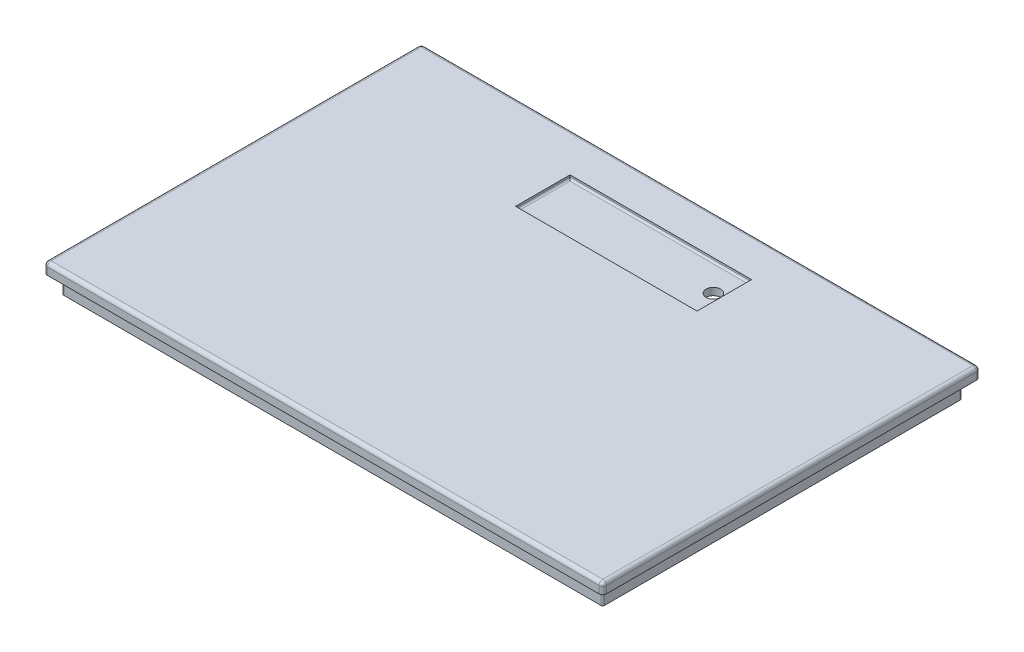
from build123d import *

# Parameters (mm, degrees)
SKETCH1_W           = 154
SKETCH1_H           = 104
BOSS_EXTRUDE1_DEPTH = 3
FILLET1_R           = 1
SKETCH2_W           = 149
SKETCH2_H           = 99
SKETCH2_W_2         = 145
SKETCH2_H_2         = 95
EXTRUDE_THIN1_DEPTH = 5
FILLET2_R           = 3
FILLET3_R           = 1
CUT_REVOLVE1_ANGLE  = 90
SKETCH5_W           = 50
SKETCH5_H           = 15
CUT_EXTRUDE1_DEPTH  = 1
FILLET4_R           = 0.5
SKETCH6_R           = 2
CUT_EXTRUDE2_DEPTH  = 5
FILLET5_R           = 0.5


with BuildPart() as part:
    # Sketch1 → Boss-Extrude1 (new body)
    with BuildSketch(Plane(origin=(0, 0, 0), x_dir=(1, 0, 0), z_dir=(0, 1, 0))):
        Rectangle(SKETCH1_W, SKETCH1_H)
    extrude(amount=BOSS_EXTRUDE1_DEPTH)

    # Fillet1
    fillet1_edges = [part.edges().sort_by_distance(p)[0] for p in [
        (-77, 3, 0),
        (0, 3, 52),
        (77, 3, 0),
        (77, 1.5, 52),
        (-77, 1.5, 52),
        (-77, 1.5, -52),
        (77, 1.5, -52),
        (0, 3, -52),
    ]]
    fillet(fillet1_edges, radius=FILLET1_R)

    # Sketch2 → Extrude-Thin1 (add)
    with BuildSketch(Plane.XZ):
        Rectangle(SKETCH2_W, SKETCH2_H)
        Rectangle(SKETCH2_W_2, SKETCH2_H_2, mode=Mode.SUBTRACT)
    extrude(amount=EXTRUDE_THIN1_DEPTH)

    # Fillet2
    fillet2_edges = [part.edges().sort_by_distance(p)[0] for p in [
        (72.5, 0, 0),
        (0, 0, 47.5),
        (-72.5, 0, 0),
        (0, 0, -47.5),
    ]]
    fillet(fillet2_edges, radius=FILLET2_R)

    # Fillet3
    fillet3_edges = [part.edges().sort_by_distance(p)[0] for p in [
        (72.5, -5, 0),
        (0, -5, 47.5),
        (-72.5, -5, 0),
        (0, -5, -47.5),
    ]]
    fillet(fillet3_edges, radius=FILLET3_R)

    # Sketch3 → Cut-Revolve1 (revolve, cut)
    with BuildSketch(Plane.ZY.offset(77)):
        with BuildLine():
            Line((-6.5, 0), (6.5, 0))
            ThreePointArc((6.5, 0), (6.060660172, 1.060660172), (5, 1.5))
            Line((5, 1.5), (-5, 1.5))
            ThreePointArc((-5, 1.5), (-6.060660172, 1.060660172), (-6.5, 0))
        make_face()
    revolve(axis=Axis((-77, 0, -6.5), (0, 0, -1)), revolution_arc=CUT_REVOLVE1_ANGLE, mode=Mode.SUBTRACT)

    # Sketch5 → Cut-Extrude1 (cut)
    with BuildSketch(Plane(origin=(0, 3, 0), x_dir=(1, 0, 0), z_dir=(0, 1, 0))):
        with Locations((0, 33.5)):
            Rectangle(SKETCH5_W, SKETCH5_H)
    extrude(amount=-CUT_EXTRUDE1_DEPTH, mode=Mode.SUBTRACT)

    # Fillet4
    fillet4_edges = [part.edges().sort_by_distance(p)[0] for p in [
        (74.5, -2.5, -49.5),
        (74.5, -2.5, 49.5),
        (-74.5, -2.5, 49.5),
        (-74.5, -2.5, -49.5),
    ]]
    fillet(fillet4_edges, radius=FILLET4_R)

    # Sketch6 → Cut-Extrude2 (cut)
    with BuildSketch(Plane(origin=(0, 2, 0), x_dir=(1, 0, 0), z_dir=(0, 1, 0))):
        with Locations(Location((22, 33.5, 0), (0, 0, 270))):
            Circle(SKETCH6_R)
    extrude(amount=-CUT_EXTRUDE2_DEPTH, mode=Mode.SUBTRACT)

    # Fillet5
    fillet5_edges = [part.edges().sort_by_distance(p)[0] for p in [
        (25, 2, -33.5),
        (0, 2, -26),
        (-25, 2, -33.5),
        (0, 2, -41),
    ]]
    fillet(fillet5_edges, radius=FILLET5_R)


solid = part.part
